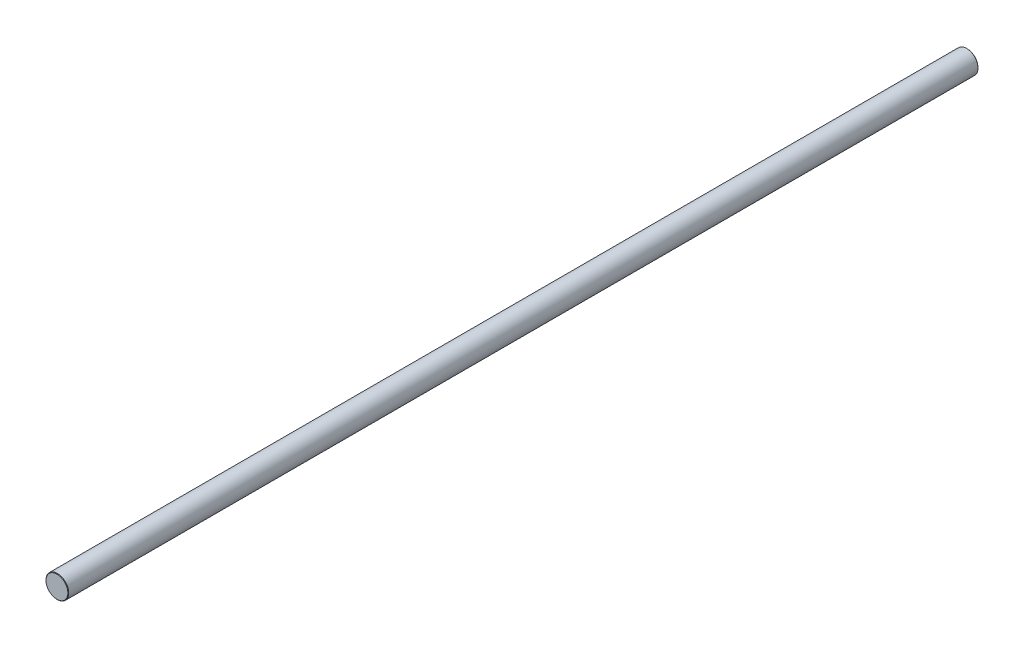
from build123d import *

# Parameters (mm, degrees)
BOSS_EXTRUDE1_DEPTH      = 200
BOSS_EXTRUDE1_DEPTH_BACK = 200
SKETCH3_R                = 5
CHAMFER1_SIZE            = 0.2


with BuildPart() as part:
    # Sketch3 → Boss-Extrude1 (new, two sides: drawn at the far end of the back side and taken through both)
    with BuildSketch(Plane.XY.offset(-BOSS_EXTRUDE1_DEPTH_BACK)):
        Circle(SKETCH3_R)
    extrude(amount=BOSS_EXTRUDE1_DEPTH + BOSS_EXTRUDE1_DEPTH_BACK)

    # Chamfer1
    chamfer1_edges = [part.edges().sort_by_distance(p)[0] for p in [
        (-5, 0, -200),
        (-5, 0, 200),
    ]]
    chamfer(chamfer1_edges, length=CHAMFER1_SIZE)


solid = part.part
